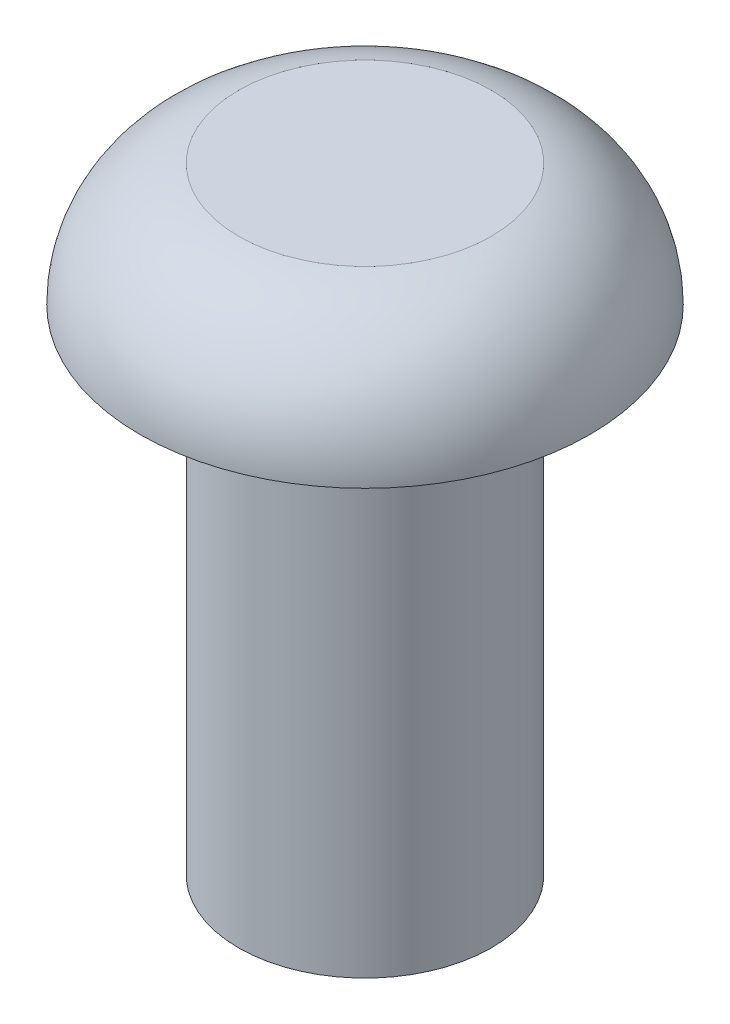
from build123d import *


with BuildPart() as part:
    # Sketch1 → Revolve1 (revolve)
    with BuildSketch(Plane.XY, mode=Mode.PRIVATE) as revolve1_sk:
        with BuildLine():
            Line((0, 0), (1.6, 0))
            Line((1.6, 0), (1.6, 6.25))
            Line((1.6, 6.25), (2.84790623, 6.25))
            ThreePointArc((2.84790623, 6.25), (2.497095548, 7.244321959), (1.6, 7.798365162))
            Line((1.6, 7.798365162), (0, 7.798365162))
            Line((0, 7.798365162), (0, 0))
        make_face()
    revolve(revolve1_sk.sketch.rotate(Axis((0, 7.798365162, 0), (0, -1, 0)), 180), axis=Axis((0, 7.798365162, 0), (0, -1, 0)))


solid = part.part
